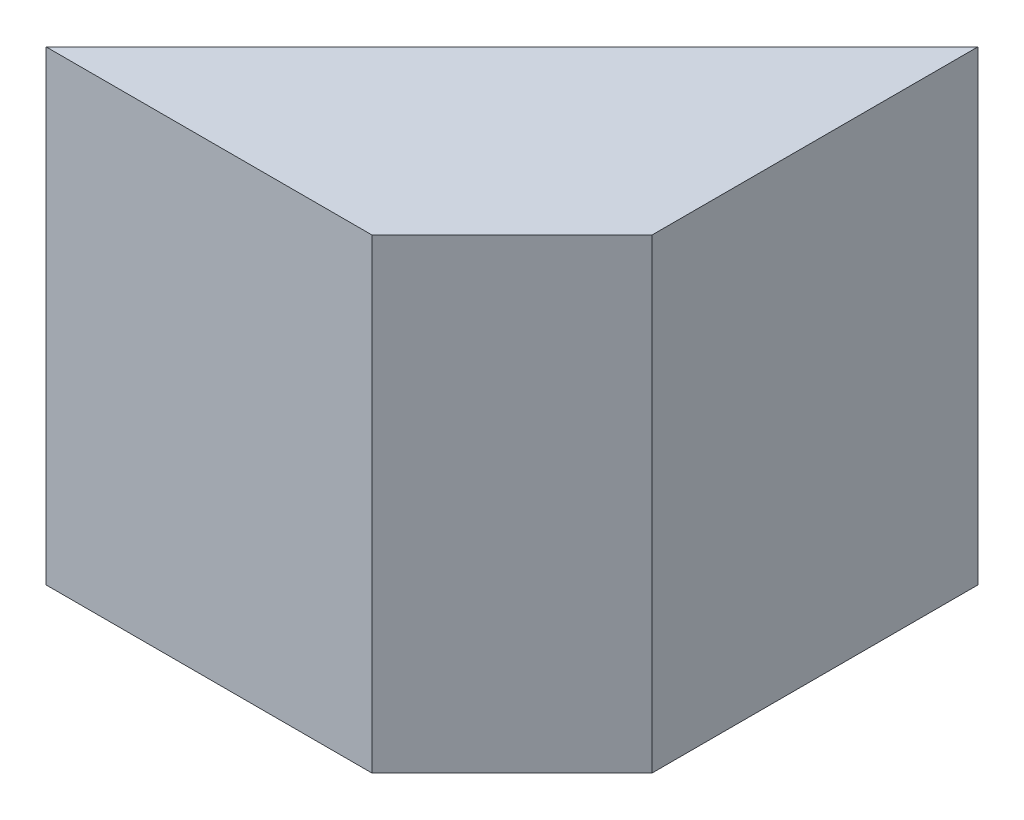
from build123d import *

# Parameters (mm, degrees)
BOSS_EXTRUDE1_DEPTH = 10
CHAMFER2_SIZE       = 3


with BuildPart() as part:
    # Sketch1 → Boss-Extrude1 (new body)
    with BuildSketch(Plane(origin=(0, 0, 0), x_dir=(1, 0, 0), z_dir=(0, 1, 0))):
        Polygon((0, 0), (10, 10), (10, 0), align=None)
    extrude(amount=BOSS_EXTRUDE1_DEPTH)

    # Chamfer2
    chamfer2_edges = [part.edges().sort_by_distance(p)[0] for p in [
        (10, 5, 0),
    ]]
    chamfer(chamfer2_edges, length=CHAMFER2_SIZE)


solid = part.part
